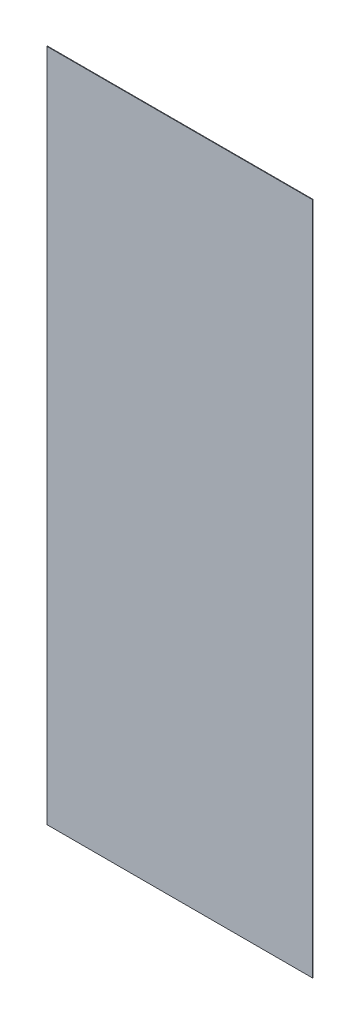
from build123d import *

# Parameters (mm, degrees)
TOPPING_DIS_ARKA_1_START = -818.5
SKETCH1_W                = 697
SKETCH1_H                = 1768.5
TOPPING_DIS_ARKA_1_DEPTH = 1.5


with BuildPart() as part:
    # Sketch1 → TOPPING_dis_arka_1 (new body)
    with BuildSketch(Plane.XY.offset(TOPPING_DIS_ARKA_1_START)):
        with Locations((350, 1084.25)):
            Rectangle(SKETCH1_W, SKETCH1_H)
    extrude(amount=-TOPPING_DIS_ARKA_1_DEPTH)


solid = part.part
